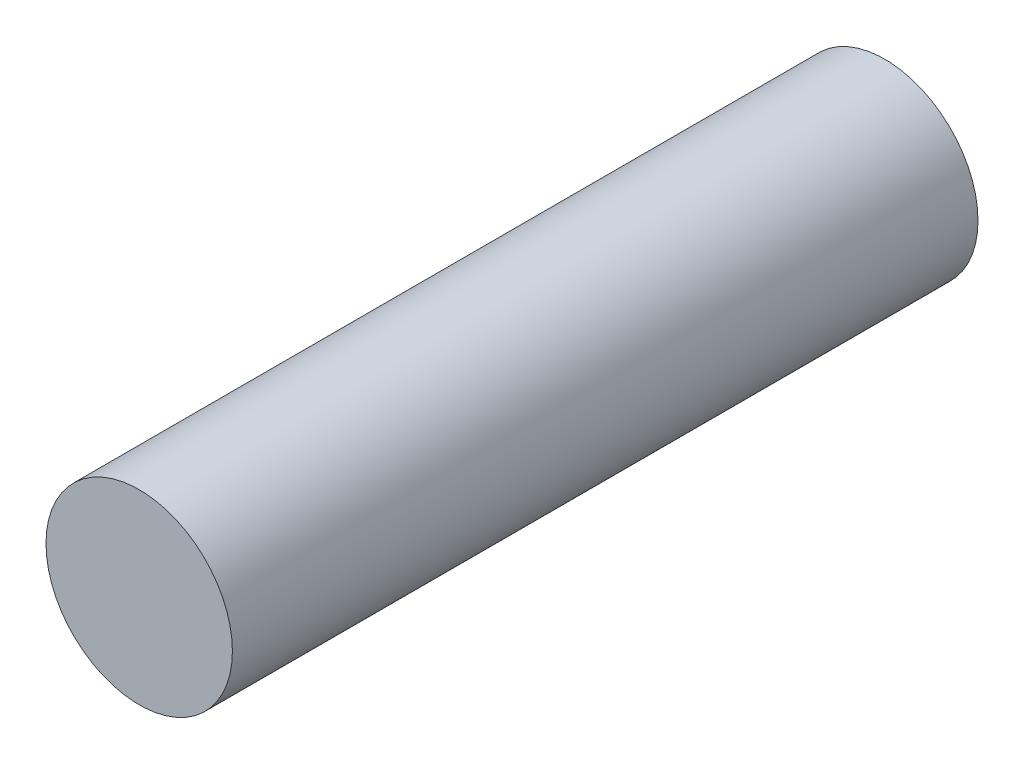
from build123d import *

# Parameters (mm, degrees)
SKETCH1_R           = 3.5
BOSS_EXTRUDE1_DEPTH = 28


with BuildPart() as part:
    # Sketch1 → Boss-Extrude1 (new body)
    with BuildSketch(Plane.XY):
        Circle(SKETCH1_R)
    extrude(amount=BOSS_EXTRUDE1_DEPTH)


solid = part.part
